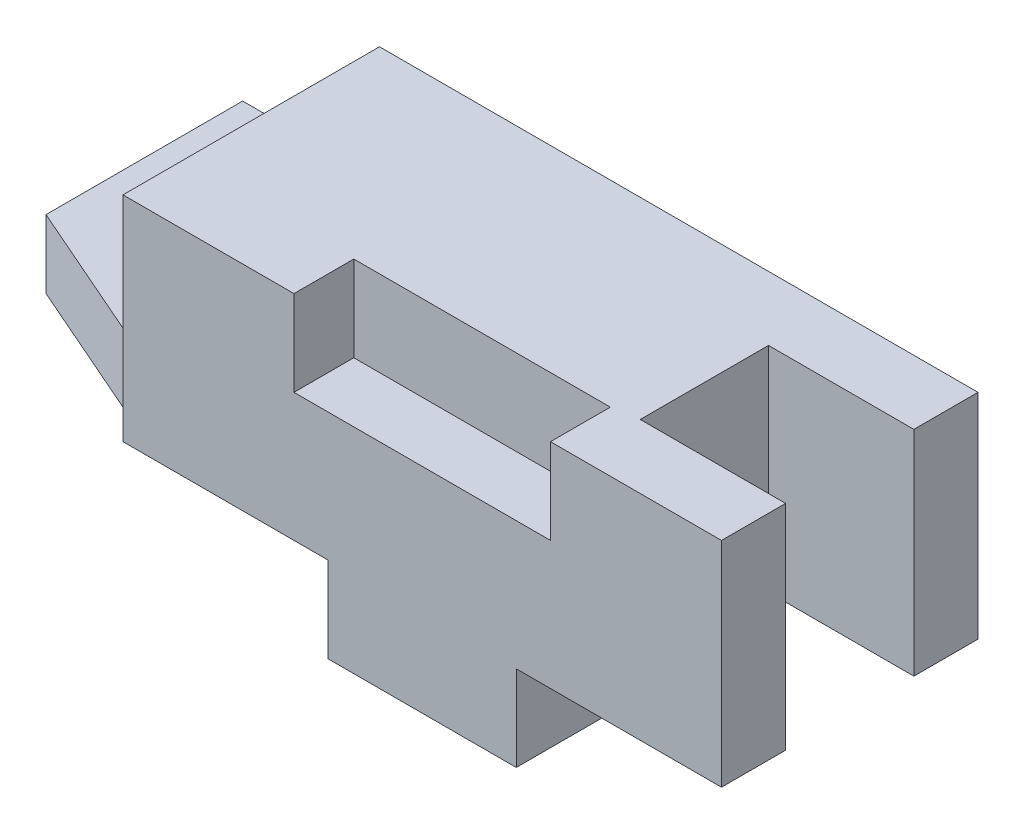
from build123d import *

# Parameters (mm, degrees)
SKETCH_1_W               = 22
SKETCH_1_H               = 10
SKETCH_1_W_2             = 16
SKETCH_1_H_2             = 8
EXTRUDE_1_DEPTH          = 30
CUT_EXTRUDE_1_DEPTH      = 30
CUT_EXTRUDE_1_DEPTH_BACK = 30
SKETCH_2_W               = 17
SKETCH_2_H               = 15
SKETCH_3_W               = 30
SKETCH_3_H               = 10
CUT_EXTRUDE_2_DEPTH      = 7


with BuildPart() as part:
    # Эскиз1 → Бобышка-Вытянуть1 (new body)
    with BuildSketch(Plane.XY):
        Polygon((-35, -7.5), (-11, -7.5), (11, -7.5), (35, -7.5), (35, 17.5), (-35, 17.5), (-35, 4), (-35, -4), align=None)
        with Locations((0, -12.5)):
            Rectangle(SKETCH_1_W, SKETCH_1_H)
        with Locations((-43, 0)):
            Rectangle(SKETCH_1_W_2, SKETCH_1_H_2)
    extrude(amount=EXTRUDE_1_DEPTH)

    # Эскиз2 → Вырез-Вытянуть1 (cut, two sides: drawn at the far end of the back side and taken through both)
    with BuildSketch(Plane.XZ.offset(4).offset(-CUT_EXTRUDE_1_DEPTH_BACK)):
        with Locations((26.5, 15)):
            Rectangle(SKETCH_2_W, SKETCH_2_H)
        Polygon((-35, 30), (-51, 30), (-51, 23), align=None)
    extrude(amount=CUT_EXTRUDE_1_DEPTH + CUT_EXTRUDE_1_DEPTH_BACK, mode=Mode.SUBTRACT)

    # Эскиз3 → Вырез-Вытянуть2 (cut)
    with BuildSketch(Plane.XY.offset(30)):
        with Locations((0, 12.5)):
            Rectangle(SKETCH_3_W, SKETCH_3_H)
    extrude(amount=-CUT_EXTRUDE_2_DEPTH, mode=Mode.SUBTRACT)


solid = part.part
